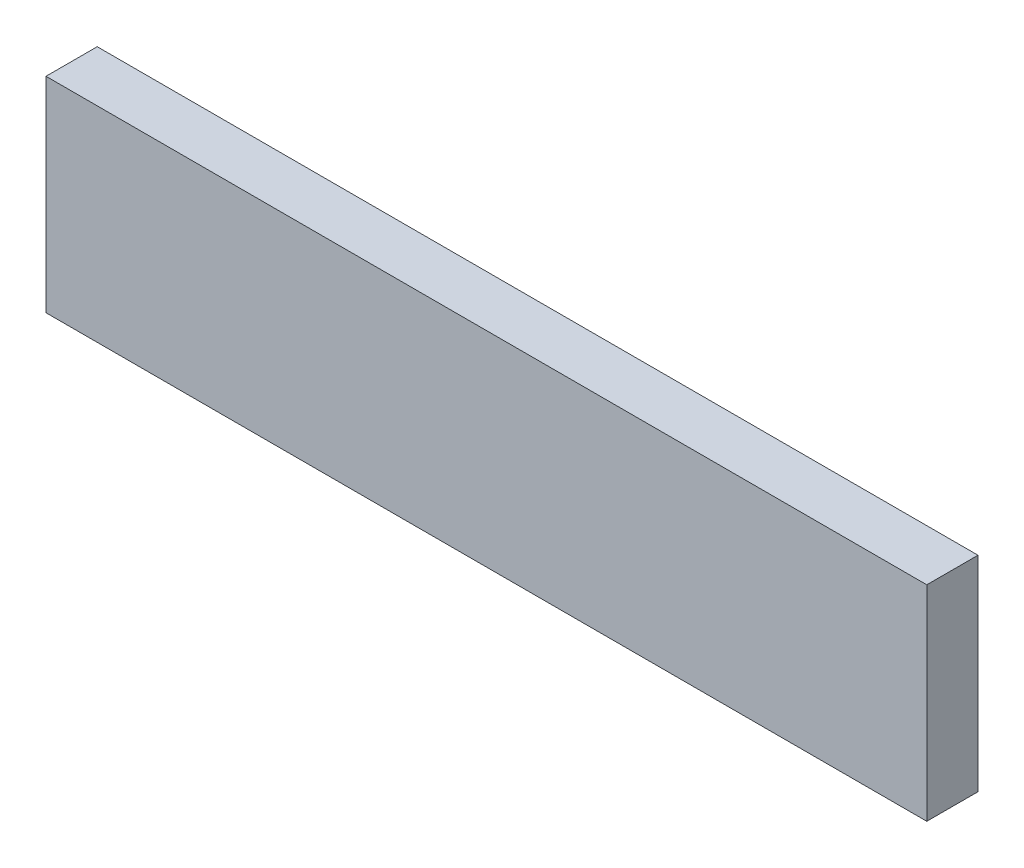
from build123d import *

# Parameters (mm, degrees)
ESQUISSE1_W        = 86
ESQUISSE1_H        = 20
BOSS_EXTRU_1_DEPTH = 5


with BuildPart() as part:
    # Esquisse1 → Boss.-Extru.1 (new body)
    with BuildSketch(Plane.XY):
        with Locations((-7.625614695, 10)):
            Rectangle(ESQUISSE1_W, ESQUISSE1_H)
    extrude(amount=BOSS_EXTRU_1_DEPTH)


solid = part.part
